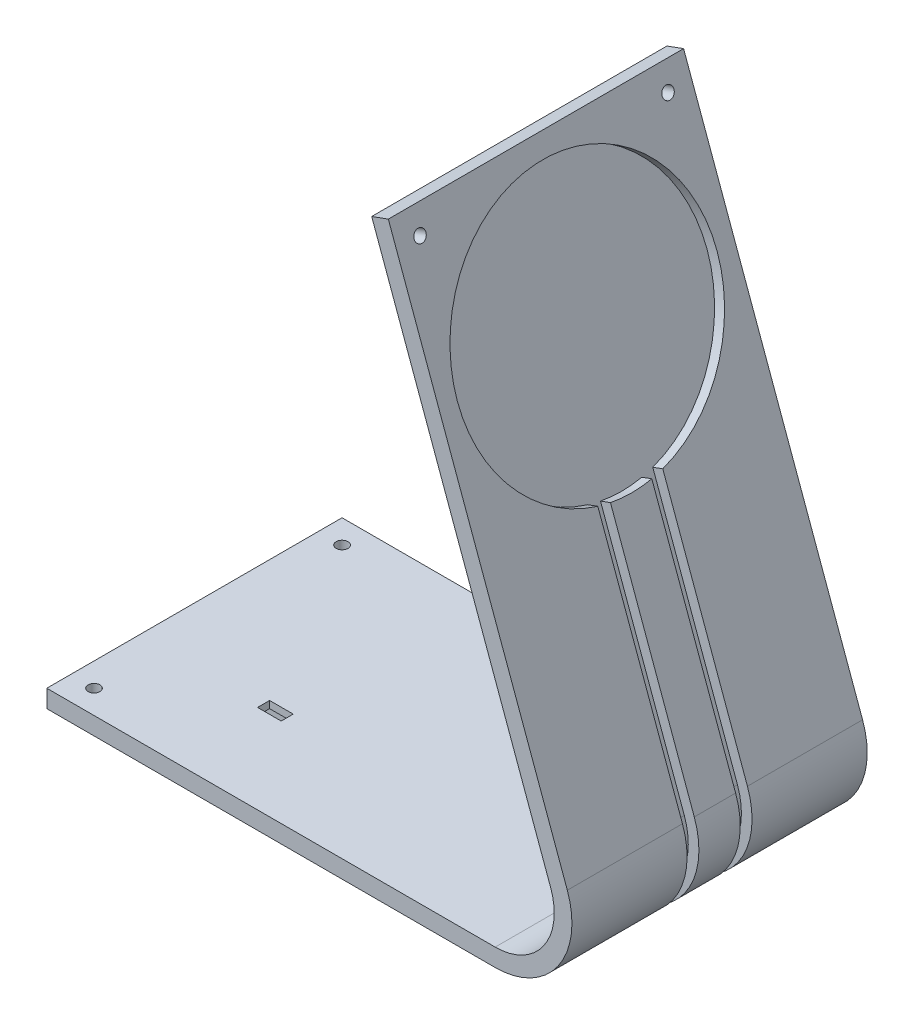
from build123d import *

# Parameters (mm, degrees)
EXTRUDE_1_DEPTH       = 25
SKETCH_4_R            = 22
CUT_EXTRUDE_1_DEPTH   = 1.8
CUT_EXTRUDE_START     = 5.5
CUT_EXTRUDE_1_2_DEPTH = 2
CUT_EXTRUDE_2_REACH   = 124.068
SKETCH_5_R            = 1
CUT_EXTRUDE_3_REACH   = 112.991
SKETCH_6_R            = 1
CUT_EXTRUDE_1_3_DEPTH = 1.8
SKETCH_8_W            = 1.7
SKETCH_8_H            = 9.2
EXTRUDE_1_2_DEPTH     = 1.7
CUT_EXTRUDE_2_2_DEPTH = 2
SKETCH_14_W           = 13.81884782
SKETCH_14_H           = 18.9
CUT_EXTRUDE_3_2_DEPTH = 1.8
EXTRUDE_2_DEPTH       = 1.8
SKETCH_16_W           = 4
SKETCH_16_H           = 2.04
CUT_EXTRUDE_4_DEPTH   = 1.2


with BuildPart() as part:
    # 草图2 → Extrude 1 (new, symmetric)
    with BuildSketch(Plane.XY):
        with BuildLine():
            Line((-42.61884782, 0), (33.310872136, 0))
            ThreePointArc((33.310872136, 0), (41.502392579, 4.264235636), (42.707798344, 13.420201433))
            Line((42.707798344, 13.420201433), (12.398479455, 96.694370679))
            Line((12.398479455, 96.694370679), (15.217557318, 97.720431109))
            Line((15.217557318, 97.720431109), (45.526876206, 14.446261863))
            ThreePointArc((45.526876206, 14.446261863), (43.959848712, 2.543506327), (33.310872136, -3))
            Line((33.310872136, -3), (-42.61884782, -3))
            Line((-42.61884782, -3), (-42.61884782, 0))
        make_face()
    extrude(amount=EXTRUDE_1_DEPTH, both=True)

    # 草图4 → Cut-Extrude 1 (cut)
    with BuildSketch(Plane(origin=(44.844182434, 16.321947586, 0), x_dir=(0, 0, -1), z_dir=(0.939692620785907, 0.3420201433256728, 0))):
        with Locations(Location((0, 61.222456878, 0), (0, 0, 90))):
            Circle(SKETCH_4_R)
    extrude(amount=-CUT_EXTRUDE_1_DEPTH, mode=Mode.SUBTRACT)

    # 草图3 → Cut-Extrude 1 2 (cut)
    with BuildSketch(Plane.XY.offset(CUT_EXTRUDE_START)):
        with BuildLine():
            Line((8.762964592, -1.2), (33.310872136, -1.2))
            ThreePointArc((33.310872136, -1.2), (42.485375032, 3.575943913), (43.835429489, 13.830625605))
            Line((43.835429489, 13.830625605), (29.737865394, 52.563364626))
            Line((29.737865394, 52.563364626), (28.711804964, 55.382442488))
            Line((28.711804964, 55.382442488), (30.403251681, 55.998078746))
            Line((30.403251681, 55.998078746), (31.429312111, 53.179000884))
            Line((31.429312111, 53.179000884), (45.526876206, 14.446261863))
            ThreePointArc((45.526876206, 14.446261863), (43.959848712, 2.543506327), (33.310872136, -3))
            Line((33.310872136, -3), (8.762964592, -3))
            Line((8.762964592, -3), (8.762964592, -1.2))
        make_face()
    cut_extrude_1_2 = extrude(amount=-CUT_EXTRUDE_1_2_DEPTH, mode=Mode.SUBTRACT)

    # 镜向1: Cut-Extrude 1 2 across plane
    add(cut_extrude_1_2.mirror(Plane.XY), mode=Mode.SUBTRACT)

    # 草图5 → Cut-Extrude 2 (cut, up to next)
    with BuildSketch(Plane(origin=(44.844182434, 16.321947586, 0), x_dir=(0, 0, -1), z_dir=(0.939692620785907, 0.3420201433256728, 0)), mode=Mode.PRIVATE) as cut_extrude_2_sk1:
        with Locations(Location((-21, 82.622456878, 0), (0, 0, 90))):
            Circle(SKETCH_5_R)
    cut_extrude_2_tool1 = extrude(cut_extrude_2_sk1.sketch, amount=-CUT_EXTRUDE_2_REACH, mode=Mode.PRIVATE) & part.part
    cut_extrude_2 = cut_extrude_2_tool1.solids().sort_by_distance((16.585638, 93.961661, 21))[0]
    add(cut_extrude_2, mode=Mode.SUBTRACT)

    # 镜向2: Cut-Extrude 2 across plane
    add(cut_extrude_2.mirror(Plane.XY), mode=Mode.SUBTRACT)

    # 草图6 → Cut-Extrude 3 (cut, up to next)
    with BuildSketch(Plane(origin=(0, 0, 0), x_dir=(1, 0, 0), z_dir=(0, 1, 0)), mode=Mode.PRIVATE) as cut_extrude_3_sk1:
        with Locations(Location((-38.61884782, -21, 0), (0, 0, 270))):
            Circle(SKETCH_6_R)
    cut_extrude_3_tool1 = extrude(cut_extrude_3_sk1.sketch, amount=-CUT_EXTRUDE_3_REACH, mode=Mode.PRIVATE) & part.part
    cut_extrude_3 = cut_extrude_3_tool1.solids().sort_by_distance((-38.618848, 0, 21))[0]
    add(cut_extrude_3, mode=Mode.SUBTRACT)

    # 镜向3: Cut-Extrude 3 across plane
    add(cut_extrude_3.mirror(Plane.XY), mode=Mode.SUBTRACT)

    # 草图7 → Cut-Extrude 1 3 (cut)
    with BuildSketch(Plane.XZ.offset(3)):
        Polygon((-40.91884782, -5.9), (-26.91884782, -5.9), (-26.91884782, 5.9), (-40.91884782, 5.9), (-40.91884782, 4.6), (-42.61884782, 4.6), (-42.61884782, -4.6), (-40.91884782, -4.6), align=None)
    extrude(amount=-CUT_EXTRUDE_1_3_DEPTH, mode=Mode.SUBTRACT)

    # 草图8 → Extrude 1 2 (add)
    with BuildSketch(Plane.XZ.offset(1.2)):
        with Locations((-41.76884782, 0)):
            Rectangle(SKETCH_8_W, SKETCH_8_H)
    extrude(amount=EXTRUDE_1_2_DEPTH)

    # 草图12 → Cut-Extrude 2 2 (cut)
    with BuildSketch(Plane.XZ.offset(3)):
        Polygon((-10.1, -8.1), (-10.1, -10.6), (15.1, -10.6), (15.1, 10.6), (-10.1, 10.6), (-10.1, 8.1), (-13.1, 8.1), (-13.1, -8.1), align=None)
    extrude(amount=-CUT_EXTRUDE_2_2_DEPTH, mode=Mode.SUBTRACT)

    # 草图14 → Cut-Extrude 3 2 (cut)
    with BuildSketch(Plane.XZ.offset(3)):
        with Locations((-20.00942391, 1.35)):
            Rectangle(SKETCH_14_W, SKETCH_14_H)
    extrude(amount=-CUT_EXTRUDE_3_2_DEPTH, mode=Mode.SUBTRACT)

    # 草图15 → 凸台-拉伸2 (add)
    with BuildSketch(Plane.XZ.offset(1.2)):
        Polygon((-25.30942391, 6.1), (-14.60942391, 6.1), (-14.60942391, 10.8), (-15.60942391, 10.8), (-15.60942391, 7.1), (-24.30942391, 7.1), (-24.30942391, 10.8), (-25.30942391, 10.8), align=None)
    extrude(amount=EXTRUDE_2_DEPTH)

    # 草图16 → 切除-拉伸4 (cut)
    with BuildSketch(Plane(origin=(0, 0, 0), x_dir=(1, 0, 0), z_dir=(0, 1, 0))):
        with Locations((-19.95942391, -8.95)):
            Rectangle(SKETCH_16_W, SKETCH_16_H)
    extrude(amount=-CUT_EXTRUDE_4_DEPTH, mode=Mode.SUBTRACT)


solid = part.part
